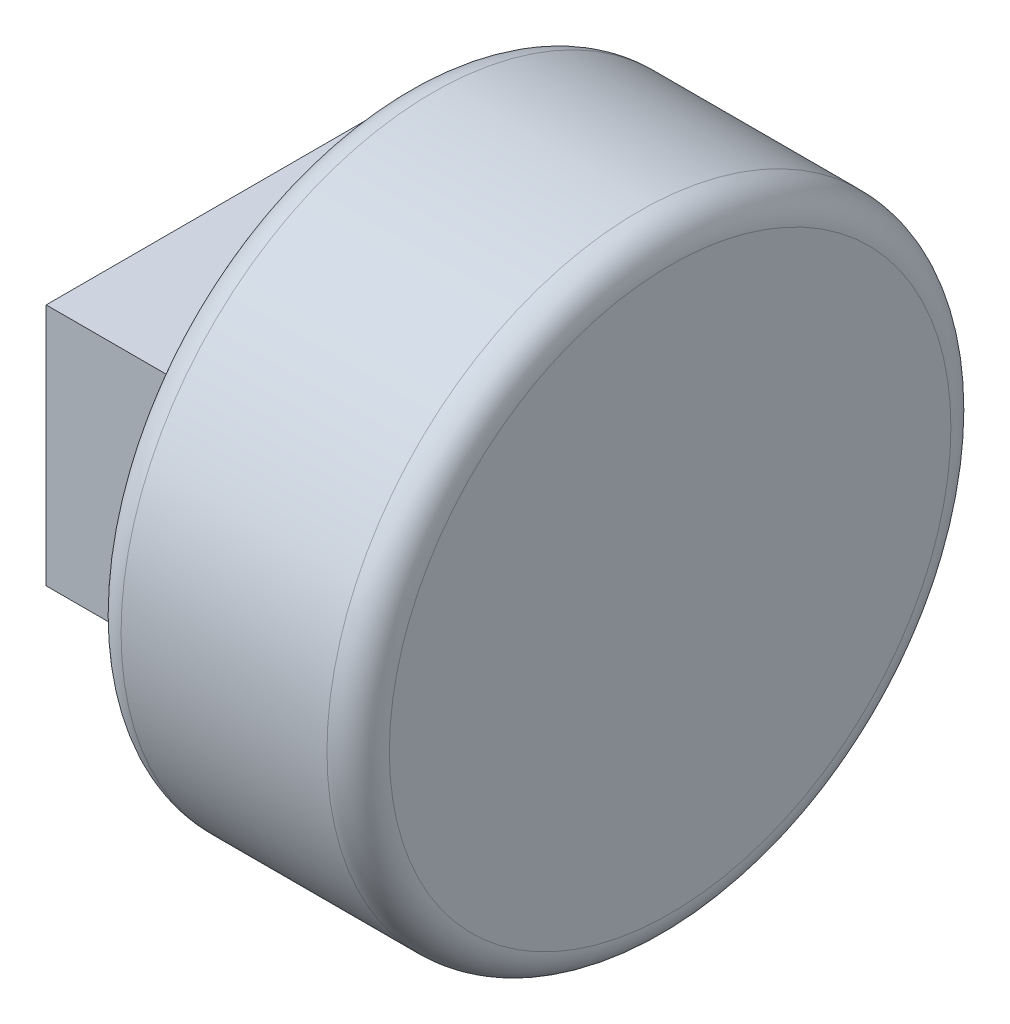
from build123d import *

# Parameters (mm, degrees)
SKETCH_2_W          = 60
SKETCH_2_H          = 39
EXTRUDE_1_DEPTH     = 70
SKETCH_3_R          = 50
EXTRUDE_2_DEPTH     = 43
FILLET_1_R          = 5
FILLET_2_R          = 5
SKETCH_4_R          = 1.5
CUT_EXTRUDE_1_DEPTH = 3.5
SKETCH_5_R          = 1.5
CUT_EXTRUDE_2_DEPTH = 3.5


with BuildPart() as part:
    # 草图2 → 凸台-拉伸1 (new body)
    with BuildSketch(Plane(origin=(0, 0, 0), x_dir=(0, 0, -1), z_dir=(1, 0, 0))):
        Rectangle(SKETCH_2_W, SKETCH_2_H)
    extrude(amount=EXTRUDE_1_DEPTH)

    # 草图3 → 凸台-拉伸2 (add)
    with BuildSketch(Plane(origin=(70, 0, 0), x_dir=(0, 0, -1), z_dir=(1, 0, 0))):
        Circle(SKETCH_3_R)
    extrude(amount=-EXTRUDE_2_DEPTH)

    # 圆角1
    fillet_1_edges = [part.edges().sort_by_distance(p)[0] for p in [
        (70, 0, 50),
    ]]
    fillet(fillet_1_edges, radius=FILLET_1_R)

    # 圆角2
    fillet_2_edges = [part.edges().sort_by_distance(p)[0] for p in [
        (27, 0, 50),
    ]]
    fillet(fillet_2_edges, radius=FILLET_2_R)

    # 草图4 → 切除-拉伸1 (cut)
    with BuildSketch(Plane(origin=(0, 19.5, 0), x_dir=(1, 0, 0), z_dir=(0, 1, 0))):
        with Locations(Location((13, 0, 0), (0, 0, 270))):
            Circle(SKETCH_4_R)
    extrude(amount=-CUT_EXTRUDE_1_DEPTH, mode=Mode.SUBTRACT)

    # 草图5 → 切除-拉伸2 (cut)
    with BuildSketch(Plane.XZ.offset(19.5)):
        with Locations(Location((8, 13.5, 0), (0, 0, 270))):
            Circle(SKETCH_5_R)
        with Locations(Location((8, -13.25, 0), (0, 0, 270))):
            Circle(SKETCH_5_R)
    extrude(amount=-CUT_EXTRUDE_2_DEPTH, mode=Mode.SUBTRACT)


solid = part.part
